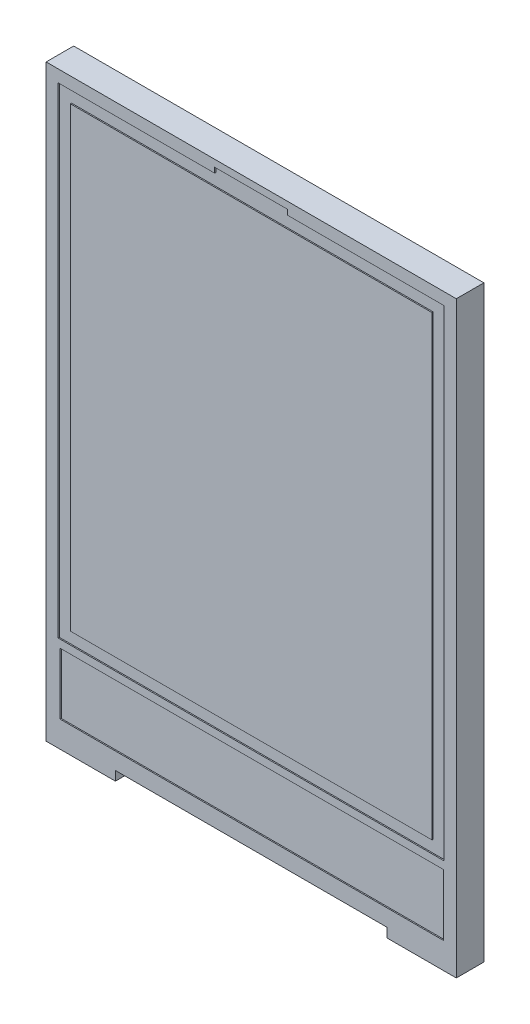
from build123d import *

# Parameters (mm, degrees)
ESQUISSE6_W             = 35.7
ESQUISSE6_H             = 51.2
BOSS_EXTRU_3_DEPTH      = 2.4
ESQUISSE7_W             = 33.59337029
ESQUISSE7_H             = 41.85
ENL_V_MAT_EXTRU_4_DEPTH = 0.1
ESQUISSE8_W             = 6.352818378
ESQUISSE8_H             = 0.449413723
ENL_V_MAT_EXTRU_5_DEPTH = 0.1
ESQUISSE9_W             = 31.478034176
ESQUISSE9_H             = 39.75
BOSS_EXTRU_4_DEPTH      = 0.1
ESQUISSE10_W            = 33.373849312
ESQUISSE10_H            = 5.346626879
ENL_V_MAT_EXTRU_6_DEPTH = 0.1
ESQUISSE11_W            = 23.638967436
ESQUISSE11_H            = 0.807997654
ENL_V_MAT_EXTRU_7_DEPTH = 63.463509347


with BuildPart() as part:
    # Esquisse6 → Boss.-Extru.3 (new body)
    with BuildSketch(Plane.XY):
        with Locations((17.85, 25.6)):
            Rectangle(ESQUISSE6_W, ESQUISSE6_H)
    extrude(amount=-BOSS_EXTRU_3_DEPTH)

    # Esquisse7 → Enlèv. mat.-Extru.4 (cut)
    with BuildSketch(Plane.XY):
        with Locations((17.85, 29.225)):
            Rectangle(ESQUISSE7_W, ESQUISSE7_H)
    extrude(amount=-ENL_V_MAT_EXTRU_4_DEPTH, mode=Mode.SUBTRACT)

    # Esquisse8 → Enlèv. mat.-Extru.5 (cut)
    with BuildSketch(Plane.XY):
        with Locations((17.85, 50.374706862)):
            Rectangle(ESQUISSE8_W, ESQUISSE8_H)
    extrude(amount=-ENL_V_MAT_EXTRU_5_DEPTH, mode=Mode.SUBTRACT)

    # Esquisse9 → Boss.-Extru.4 (add)
    with BuildSketch(Plane.XY.offset(-0.1)):
        with Locations((17.85, 29.225)):
            Rectangle(ESQUISSE9_W, ESQUISSE9_H)
    extrude(amount=BOSS_EXTRU_4_DEPTH)

    # Esquisse10 → Enlèv. mat.-Extru.6 (cut)
    with BuildSketch(Plane.XY):
        with Locations((17.915693231, 4.94567387)):
            Rectangle(ESQUISSE10_W, ESQUISSE10_H)
    extrude(amount=-ENL_V_MAT_EXTRU_6_DEPTH, mode=Mode.SUBTRACT)

    # Esquisse11 → Enlèv. mat.-Extru.7 (cut, through all)
    with BuildSketch(Plane.XY):
        with Locations((17.85, 0.403998827)):
            Rectangle(ESQUISSE11_W, ESQUISSE11_H)
    extrude(amount=-ENL_V_MAT_EXTRU_7_DEPTH, mode=Mode.SUBTRACT)


solid = part.part
